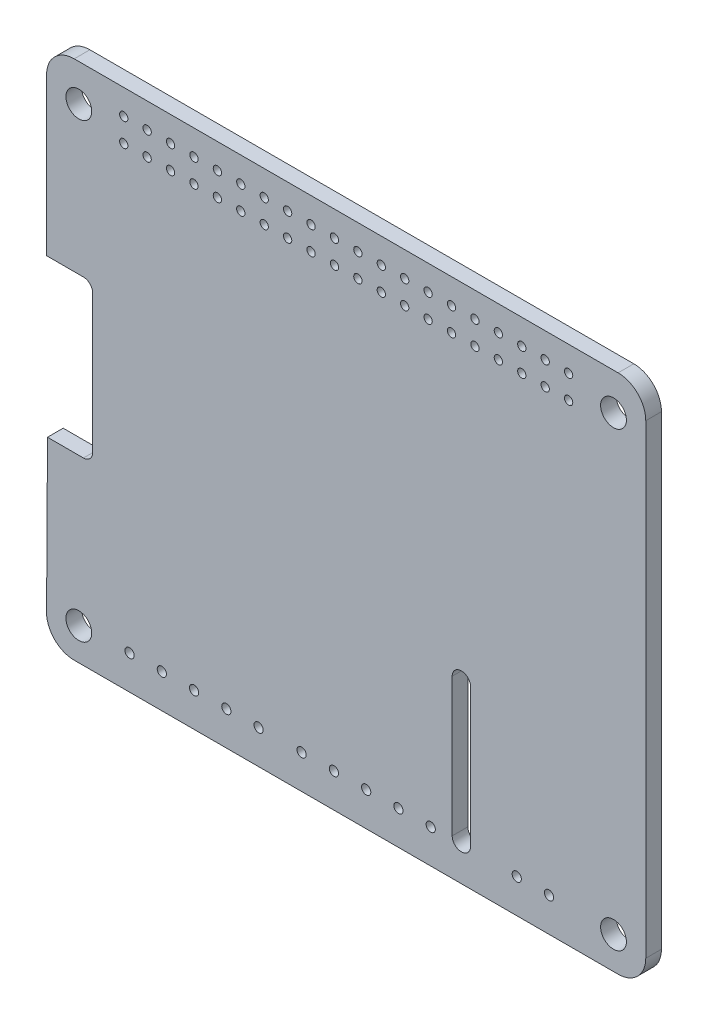
from build123d import *

# Parameters (mm, degrees)
SKETCH2_R           = 1.4
SKETCH2_R_2         = 0.45
SKETCH2_R_3         = 0.5
BOSS_EXTRUDE1_DEPTH = 1.7


with BuildPart() as part:
    # Sketch2 → Boss-Extrude1 (new body)
    with BuildSketch(Plane.XY):
        with BuildLine():
            Line((29.5, 28.25), (-29.5, 28.25))
            ThreePointArc((-29.5, 28.25), (-31.621320344, 27.371320344), (-32.5, 25.25))
            Line((-32.5, 25.25), (-32.5, 8.25))
            Line((-32.5, 8.25), (-28.5, 8.25))
            ThreePointArc((-28.5, 8.25), (-27.792893219, 7.957106781), (-27.5, 7.25))
            Line((-27.5, 7.25), (-27.5, -7.75))
            ThreePointArc((-27.5, -7.75), (-27.792893219, -8.457106781), (-28.5, -8.75))
            Line((-28.5, -8.75), (-32.4, -8.75))
            Line((-32.4, -8.75), (-32.5, -25.25))
            ThreePointArc((-32.5, -25.25), (-31.626652319, -27.376652319), (-29.5, -28.25))
            Line((-29.5, -28.25), (29.5, -28.25))
            ThreePointArc((29.5, -28.25), (31.621320344, -27.371320344), (32.5, -25.25))
            Line((32.5, -25.25), (32.5, 25.25))
            ThreePointArc((32.5, 25.25), (31.621320344, 27.371320344), (29.5, 28.25))
        make_face()
        with Locations((-29, -24.75)):
            Circle(SKETCH2_R, mode=Mode.SUBTRACT)
        with Locations((-29, 24.25)):
            Circle(SKETCH2_R, mode=Mode.SUBTRACT)
        with Locations((29, 24.25)):
            Circle(SKETCH2_R, mode=Mode.SUBTRACT)
        with Locations((29, -24.75)):
            Circle(SKETCH2_R, mode=Mode.SUBTRACT)
        with Locations((-24.13, 25.52)):
            Circle(SKETCH2_R_2, mode=Mode.SUBTRACT)
        with Locations((-21.59, 25.52)):
            Circle(SKETCH2_R_2, mode=Mode.SUBTRACT)
        with Locations((-19.05, 25.52)):
            Circle(SKETCH2_R_2, mode=Mode.SUBTRACT)
        with Locations((-16.51, 25.52)):
            Circle(SKETCH2_R_2, mode=Mode.SUBTRACT)
        with Locations((-13.97, 25.52)):
            Circle(SKETCH2_R_2, mode=Mode.SUBTRACT)
        with Locations((-11.43, 25.52)):
            Circle(SKETCH2_R_2, mode=Mode.SUBTRACT)
        with Locations((-8.89, 25.52)):
            Circle(SKETCH2_R_2, mode=Mode.SUBTRACT)
        with Locations((-6.35, 25.52)):
            Circle(SKETCH2_R_2, mode=Mode.SUBTRACT)
        with Locations((-3.81, 25.52)):
            Circle(SKETCH2_R_2, mode=Mode.SUBTRACT)
        with Locations((-1.27, 25.52)):
            Circle(SKETCH2_R_2, mode=Mode.SUBTRACT)
        with Locations((1.27, 25.52)):
            Circle(SKETCH2_R_2, mode=Mode.SUBTRACT)
        with Locations((3.81, 25.52)):
            Circle(SKETCH2_R_2, mode=Mode.SUBTRACT)
        with Locations((6.35, 25.52)):
            Circle(SKETCH2_R_2, mode=Mode.SUBTRACT)
        with Locations((8.89, 25.52)):
            Circle(SKETCH2_R_2, mode=Mode.SUBTRACT)
        with Locations((11.43, 25.52)):
            Circle(SKETCH2_R_2, mode=Mode.SUBTRACT)
        with Locations((13.97, 25.52)):
            Circle(SKETCH2_R_2, mode=Mode.SUBTRACT)
        with Locations((16.51, 25.52)):
            Circle(SKETCH2_R_2, mode=Mode.SUBTRACT)
        with Locations((19.05, 25.52)):
            Circle(SKETCH2_R_2, mode=Mode.SUBTRACT)
        with Locations((21.59, 25.52)):
            Circle(SKETCH2_R_2, mode=Mode.SUBTRACT)
        with Locations((24.13, 25.52)):
            Circle(SKETCH2_R_2, mode=Mode.SUBTRACT)
        with Locations((-21.59, 22.98)):
            Circle(SKETCH2_R_2, mode=Mode.SUBTRACT)
        with Locations((-19.05, 22.98)):
            Circle(SKETCH2_R_2, mode=Mode.SUBTRACT)
        with Locations((-16.51, 22.98)):
            Circle(SKETCH2_R_2, mode=Mode.SUBTRACT)
        with Locations((-13.97, 22.98)):
            Circle(SKETCH2_R_2, mode=Mode.SUBTRACT)
        with Locations((-11.43, 22.98)):
            Circle(SKETCH2_R_2, mode=Mode.SUBTRACT)
        with Locations((-8.89, 22.98)):
            Circle(SKETCH2_R_2, mode=Mode.SUBTRACT)
        with Locations((-6.35, 22.98)):
            Circle(SKETCH2_R_2, mode=Mode.SUBTRACT)
        with Locations((-3.81, 22.98)):
            Circle(SKETCH2_R_2, mode=Mode.SUBTRACT)
        with Locations((-1.27, 22.98)):
            Circle(SKETCH2_R_2, mode=Mode.SUBTRACT)
        with Locations((1.27, 22.98)):
            Circle(SKETCH2_R_2, mode=Mode.SUBTRACT)
        with Locations((3.81, 22.98)):
            Circle(SKETCH2_R_2, mode=Mode.SUBTRACT)
        with Locations((6.35, 22.98)):
            Circle(SKETCH2_R_2, mode=Mode.SUBTRACT)
        with Locations((8.89, 22.98)):
            Circle(SKETCH2_R_2, mode=Mode.SUBTRACT)
        with Locations((11.43, 22.98)):
            Circle(SKETCH2_R_2, mode=Mode.SUBTRACT)
        with Locations((13.97, 22.98)):
            Circle(SKETCH2_R_2, mode=Mode.SUBTRACT)
        with Locations((16.51, 22.98)):
            Circle(SKETCH2_R_2, mode=Mode.SUBTRACT)
        with Locations((19.05, 22.98)):
            Circle(SKETCH2_R_2, mode=Mode.SUBTRACT)
        with Locations((21.59, 22.98)):
            Circle(SKETCH2_R_2, mode=Mode.SUBTRACT)
        with Locations((24.13, 22.98)):
            Circle(SKETCH2_R_2, mode=Mode.SUBTRACT)
        with Locations((-24.13, 22.98)):
            Circle(SKETCH2_R_2, mode=Mode.SUBTRACT)
        with Locations((-23.498, -24.567)):
            Circle(SKETCH2_R_3, mode=Mode.SUBTRACT)
        with Locations((-19.998, -24.567)):
            Circle(SKETCH2_R_3, mode=Mode.SUBTRACT)
        with Locations((-16.498, -24.567)):
            Circle(SKETCH2_R_3, mode=Mode.SUBTRACT)
        with Locations((-12.998, -24.567)):
            Circle(SKETCH2_R_3, mode=Mode.SUBTRACT)
        with Locations((-9.498, -24.567)):
            Circle(SKETCH2_R_3, mode=Mode.SUBTRACT)
        with Locations((-4.829, -24.567)):
            Circle(SKETCH2_R_3, mode=Mode.SUBTRACT)
        with Locations((-1.329, -24.567)):
            Circle(SKETCH2_R_3, mode=Mode.SUBTRACT)
        with Locations((2.171, -24.567)):
            Circle(SKETCH2_R_3, mode=Mode.SUBTRACT)
        with Locations((5.671, -24.567)):
            Circle(SKETCH2_R_3, mode=Mode.SUBTRACT)
        with Locations((9.171, -24.567)):
            Circle(SKETCH2_R_3, mode=Mode.SUBTRACT)
        with Locations((18.505, -24.567)):
            Circle(SKETCH2_R_3, mode=Mode.SUBTRACT)
        with Locations((22.005, -24.567)):
            Circle(SKETCH2_R_3, mode=Mode.SUBTRACT)
        with BuildLine():
            Line((13.5, -9.25), (13.5, -24.25))
            ThreePointArc((13.5, -24.25), (12.5, -25.25), (11.5, -24.25))
            Line((11.5, -24.25), (11.5, -9.25))
            ThreePointArc((11.5, -9.25), (12.5, -8.25), (13.5, -9.25))
        make_face(mode=Mode.SUBTRACT)
    extrude(amount=BOSS_EXTRUDE1_DEPTH)


solid = part.part
